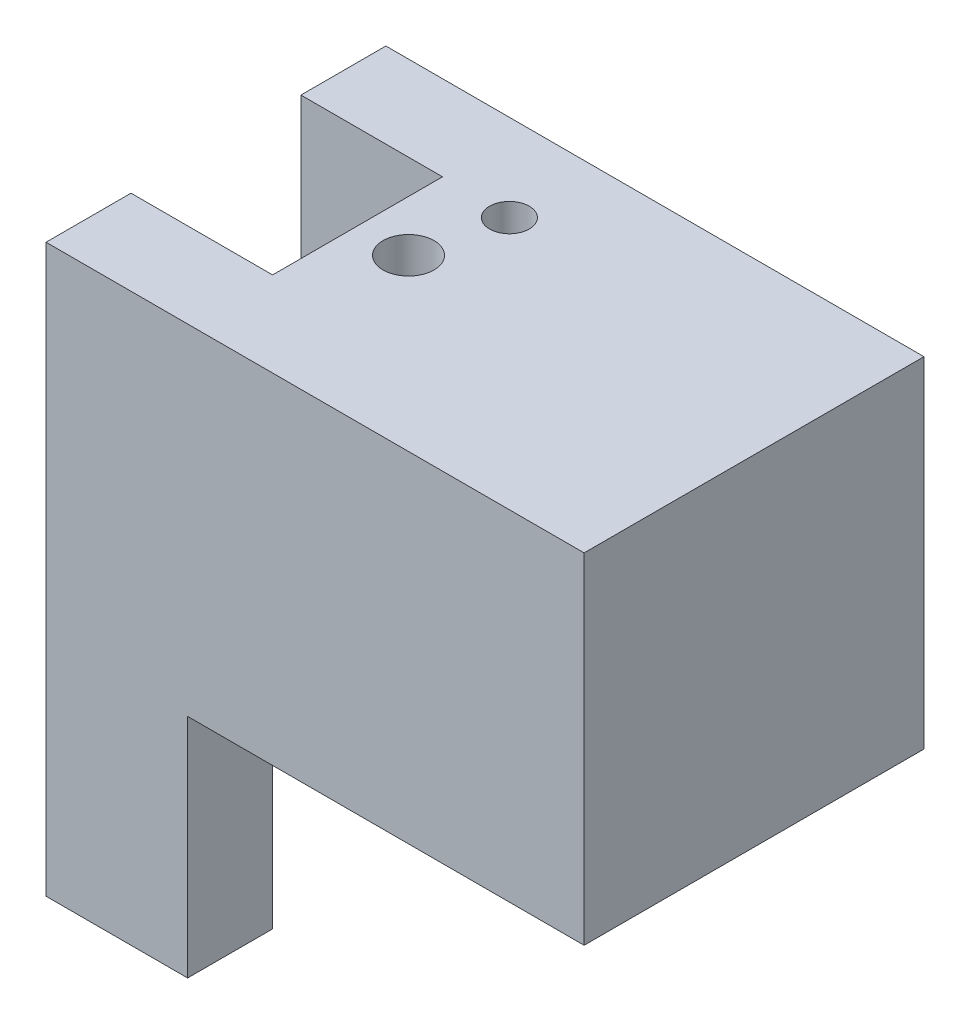
from build123d import *

# Parameters (mm, degrees)
ESQUISSE1_W                = 70
ESQUISSE1_H                = 60
BOSS_EXTRU_1_DEPTH         = 60
ESQUISSE2_W                = 15
ESQUISSE2_H                = 60
BOSS_EXTRU_2_DEPTH         = 25
ESQUISSE3_W                = 25
ESQUISSE3_H                = 15
BOSS_EXTRU_3_DEPTH         = 40
TROU_TARAUD_M8X1_01_D      = 7
TROU_TARAUD_M8X1_01_DEPTH  = 21
TROU_TARAUD_M8X1_01_TIP    = 2.103012167
TROU_TARAUD_M10X1_02_D     = 9
TROU_TARAUD_M10X1_02_DEPTH = 25
TROU_TARAUD_M10X1_02_TIP   = 2.703872786
ENL_V_MAT_EXTRU_3_REACH    = 131.67
ESQUISSE4_R                = 4.5


with BuildPart() as part:
    # Esquisse1 → Boss.-Extru.1 (new body)
    with BuildSketch(Plane.XY):
        with Locations((-38.052617229, 47.387919463)):
            Rectangle(ESQUISSE1_W, ESQUISSE1_H)
    extrude(amount=BOSS_EXTRU_1_DEPTH)

    # Esquisse2 → Boss.-Extru.2 (add)
    with BuildSketch(Plane.ZY.offset(73.052617229)):
        with Locations((7.5, 47.387919463)):
            Rectangle(ESQUISSE2_W, ESQUISSE2_H)
        with Locations((52.5, 47.387919463)):
            Rectangle(ESQUISSE2_W, ESQUISSE2_H)
    extrude(amount=BOSS_EXTRU_2_DEPTH)

    # Esquisse3 → Boss.-Extru.3 (add)
    with BuildSketch(Plane.XZ.offset(-17.387919463)):
        with Locations((-85.552617229, 52.5)):
            Rectangle(ESQUISSE3_W, ESQUISSE3_H)
        with Locations((-85.552617229, 7.5)):
            Rectangle(ESQUISSE3_W, ESQUISSE3_H)
    extrude(amount=BOSS_EXTRU_3_DEPTH)

    # Trou taraudé M8x1.01
    with Locations(Plane(origin=(-60.909201033, 77.387919463, 15.33448507), x_dir=(0, 0, 1), z_dir=(0, 1, 0))):
        with Locations((0, 0)):
            Hole(TROU_TARAUD_M8X1_01_D / 2, depth=TROU_TARAUD_M8X1_01_DEPTH)
            with Locations((0, 0, -(TROU_TARAUD_M8X1_01_DEPTH + TROU_TARAUD_M8X1_01_TIP / 2))):  # 118° drill point
                Cone(0, TROU_TARAUD_M8X1_01_D / 2, TROU_TARAUD_M8X1_01_TIP, mode=Mode.SUBTRACT)

    # Trou taraudé M10x1.02
    with Locations(Plane(origin=(-64.052617229, 17.387919463, 30), x_dir=(0, 0, -1), z_dir=(0, -1, 0))):
        with Locations((0, 0)):
            Hole(TROU_TARAUD_M10X1_02_D / 2, depth=TROU_TARAUD_M10X1_02_DEPTH)
            with Locations((0, 0, -(TROU_TARAUD_M10X1_02_DEPTH + TROU_TARAUD_M10X1_02_TIP / 2))):  # 118° drill point
                Cone(0, TROU_TARAUD_M10X1_02_D / 2, TROU_TARAUD_M10X1_02_TIP, mode=Mode.SUBTRACT)

    # Esquisse4 → Enlèv. mat.-Extru.3 (cut, up to next)
    with BuildSketch(Plane.XZ.offset(-17.387919463), mode=Mode.PRIVATE) as enl_v_mat_extru_3_sk1:
        with Locations(Location((-64.052617229, 30, 0), (0, 0, 270))):
            Circle(ESQUISSE4_R)
    enl_v_mat_extru_3_tool1 = extrude(enl_v_mat_extru_3_sk1.sketch, amount=-ENL_V_MAT_EXTRU_3_REACH, mode=Mode.PRIVATE) & part.part
    add(enl_v_mat_extru_3_tool1.solids().sort_by_distance((-64.052617, 17.387919, 30))[0], mode=Mode.SUBTRACT)


solid = part.part
